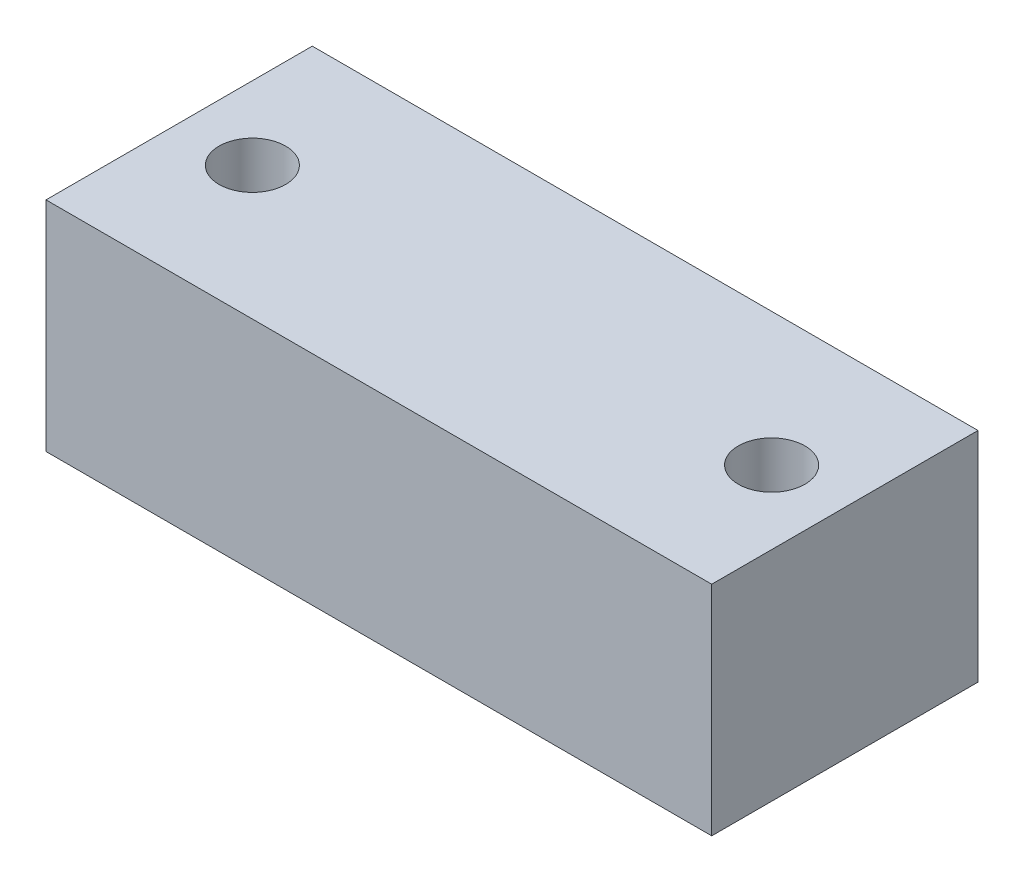
from build123d import *

# Parameters (mm, degrees)
SKETCH1_W           = 50
SKETCH1_H           = 20
BOSS_EXTRUDE1_DEPTH = 16.37
SKETCH3_R           = 2.5
CUT_EXTRUDE2_DEPTH  = 32.511535983


with BuildPart() as part:
    # Sketch1 → Boss-Extrude1 (new body)
    with BuildSketch(Plane(origin=(0, 0, 0), x_dir=(1, 0, 0), z_dir=(0, 1, 0))):
        Rectangle(SKETCH1_W, SKETCH1_H)
    extrude(amount=BOSS_EXTRUDE1_DEPTH)

    # Sketch3 → Cut-Extrude2 (cut, through all)
    with BuildSketch(Plane(origin=(0, 16.37, 0), x_dir=(1, 0, 0), z_dir=(0, 1, 0))):
        with Locations(Location((19.5, 0, 0), (0, 0, 270))):
            Circle(SKETCH3_R)
        with Locations(Location((-19.5, 0, 0), (0, 0, 270))):
            Circle(SKETCH3_R)
    extrude(amount=-CUT_EXTRUDE2_DEPTH, mode=Mode.SUBTRACT)


solid = part.part
